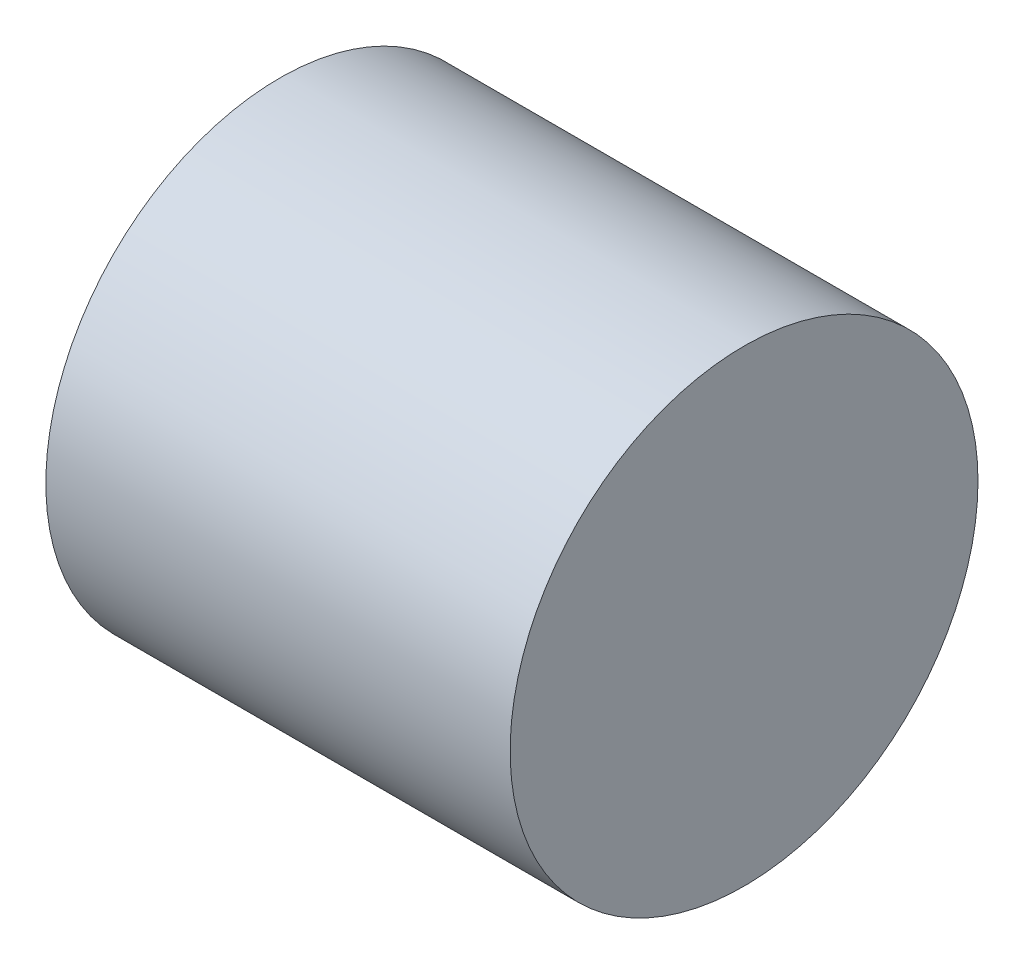
from build123d import *

# Parameters (mm, degrees)
SKETCH1_R           = 5.119071812
BOSS_EXTRUDE1_DEPTH = 10.16


with BuildPart() as part:
    # Sketch1 → Boss-Extrude1 (new body)
    with BuildSketch(Plane(origin=(0, 0, 0), x_dir=(0, 0, -1), z_dir=(1, 0, 0))):
        with Locations((-7.977955169, 45.822101484)):
            Circle(SKETCH1_R)
    extrude(amount=BOSS_EXTRUDE1_DEPTH)


solid = part.part
